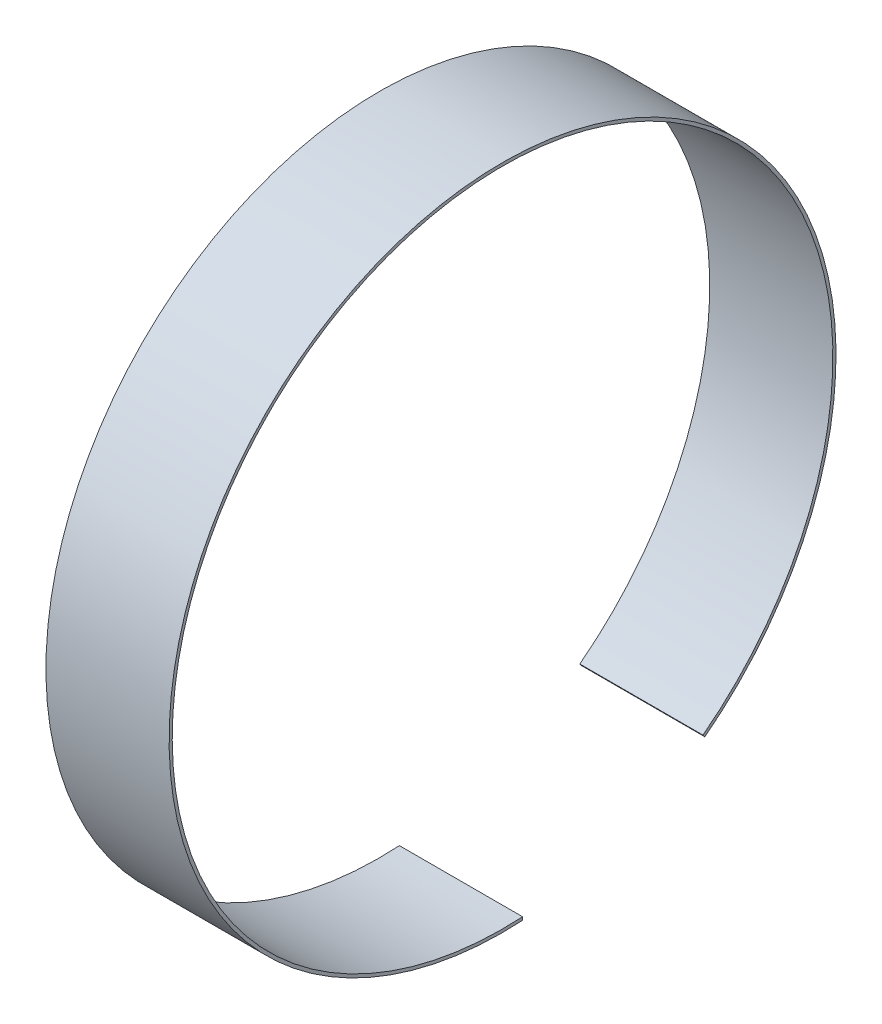
from build123d import *

# Parameters (mm, degrees)
BOSS_EXTRUDE1_DEPTH = 13.85


with BuildPart() as part:
    # Sketch1 → Boss-Extrude1 (new, symmetric)
    with BuildSketch(Plane(origin=(0, 0, 0), x_dir=(0, 0, -1), z_dir=(1, 0, 0))):
        with BuildLine():
            ThreePointArc((75, 0), (-54.60082417, 51.417409503), (4.5, -74.864878281))
            Line((4.5, -74.864878281), (4.458, -74.166139417))
            ThreePointArc((4.458, -74.166139417), (-54.091216477, 50.937513681), (74.3, 0))
            ThreePointArc((74.3, 0), (66.712592514, -32.709631609), (45.5, -58.738743602))
            Line((45.5, -58.738743602), (45.5, -59.621724229))
            ThreePointArc((45.5, -59.621724229), (67.221648299, -33.260336739), (75, 0))
        make_face()
        with BuildLine():
            Line((4.458, -74.166139417), (4.5, -74.864878281))
            Line((4.5, -74.864878281), (4.5, -74.163602933))
            ThreePointArc((4.5, -74.163602933), (4.47900018, -74.164874148), (4.458, -74.166139417))
        make_face()
        with BuildLine():
            Line((45.075333333, -59.065254803), (45.5, -59.621724229))
            Line((45.5, -59.621724229), (45.5, -58.738743602))
            ThreePointArc((45.5, -58.738743602), (45.287960922, -58.902381917), (45.075333333, -59.065254803))
        make_face()
    extrude(amount=BOSS_EXTRUDE1_DEPTH, both=True)


solid = part.part
